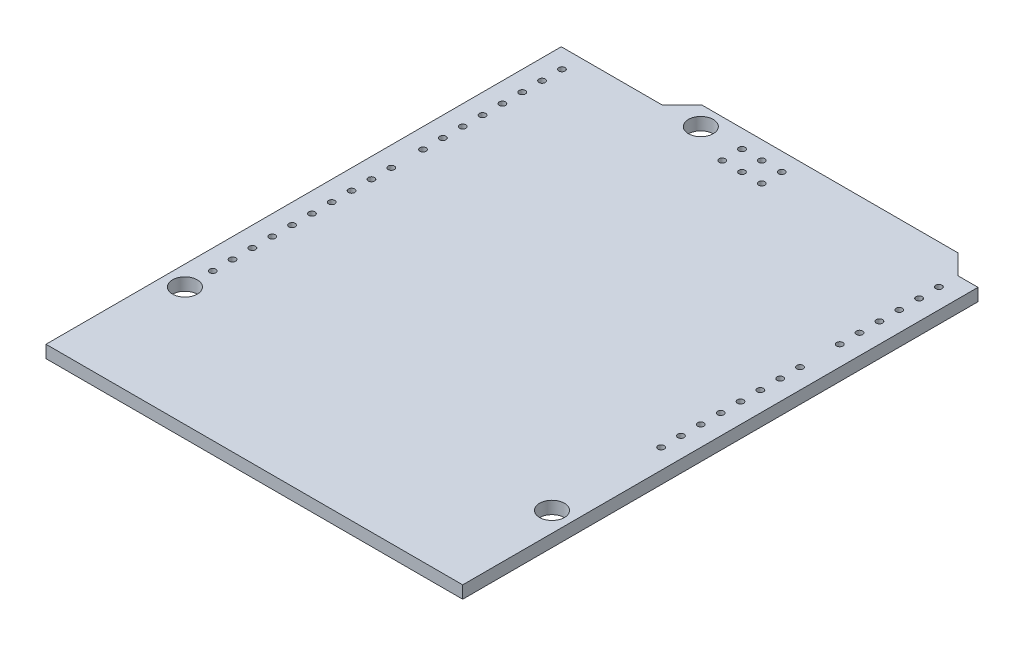
from build123d import *

# Parameters (mm, degrees)
SKETCH1_R           = 1.5875
BOSS_EXTRUDE1_DEPTH = 1.6
SKETCH2_R           = 0.4
CUT_EXTRUDE1_DEPTH  = 1.65
SKETCH3_R           = 0.4
CUT_EXTRUDE2_DEPTH  = 1.65
LPATTERN1_COUNT     = 15
LPATTERN1_PITCH     = 2.54
SKETCH4_R           = 0.4
CUT_EXTRUDE3_DEPTH  = 1.65
LPATTERN2_COUNT     = 10
LPATTERN2_PITCH     = 2.54
LPATTERN3_COUNT     = 17
LPATTERN3_PITCH     = 2.54
SKETCH5_R           = 0.4
CUT_EXTRUDE4_DEPTH  = 10


with BuildPart() as part:
    # Sketch1 → Boss-Extrude1 (new body)
    with BuildSketch(Plane(origin=(0, 0, 0), x_dir=(1, 0, 0), z_dir=(0, 1, 0))):
        Polygon((0, 0), (-53.34, 0), (-53.34, 65.96), (-40.386, 65.96), (-37.846, 68.5), (-5.08, 68.5), (-2.54, 65.96), (0, 65.96), align=None)
        with Locations(Location((-35.56, 66.04, 0), (0, 0, 270))):
            Circle(SKETCH1_R, mode=Mode.SUBTRACT)
        with Locations(Location((-2.54, 13.97, 0), (0, 0, 270))):
            Circle(SKETCH1_R, mode=Mode.SUBTRACT)
        with Locations(Location((-50.8, 15.24, 0), (0, 0, 270))):
            Circle(SKETCH1_R, mode=Mode.SUBTRACT)
    extrude(amount=-BOSS_EXTRUDE1_DEPTH)

    # Sketch2 → Cut-Extrude1 (cut)
    with BuildSketch(Plane(origin=(0, 0, 0), x_dir=(1, 0, 0), z_dir=(0, 1, 0))):
        with Locations(Location((-2.54, 27.94, 0), (0, 0, 270))):
            Circle(SKETCH2_R)
    cut_extrude1 = extrude(amount=-CUT_EXTRUDE1_DEPTH, mode=Mode.SUBTRACT)

    # Sketch3 → Cut-Extrude2 (cut)
    with BuildSketch(Plane(origin=(0, 0, 0), x_dir=(1, 0, 0), z_dir=(0, 1, 0))):
        with Locations(Location((-50.8, 18.796, 0), (0, 0, 270))):
            Circle(SKETCH3_R)
    cut_extrude2 = extrude(amount=-CUT_EXTRUDE2_DEPTH, mode=Mode.SUBTRACT)

    # LPattern1: Cut-Extrude1 ×15, 1 skipped
    with Locations(*[(0, 0, -i * LPATTERN1_PITCH) for i in range(1, LPATTERN1_COUNT) if i not in (8,)]):
        add(cut_extrude1, mode=Mode.SUBTRACT)

    # Sketch4 → Cut-Extrude3 (cut)
    with BuildSketch(Plane(origin=(0, 0, 0), x_dir=(1, 0, 0), z_dir=(0, 1, 0))):
        with Locations(Location((-50.8, 45.72, 0), (0, 0, 270))):
            Circle(SKETCH4_R)
    cut_extrude3 = extrude(amount=-CUT_EXTRUDE3_DEPTH, mode=Mode.SUBTRACT)

    # LPattern2: Cut-Extrude2 ×10
    with Locations(*[(0, 0, -i * LPATTERN2_PITCH) for i in range(1, LPATTERN2_COUNT)]):
        add(cut_extrude2, mode=Mode.SUBTRACT)

    # LPattern3: Cut-Extrude3 ×17, 1 skipped
    with Locations(*[(0, 0, -i * LPATTERN3_PITCH) for i in range(1, LPATTERN3_COUNT) if i not in (8,)]):
        add(cut_extrude3, mode=Mode.SUBTRACT)

    # Sketch5 → Cut-Extrude4 (cut)
    with BuildSketch(Plane(origin=(0, 0, 0), x_dir=(1, 0, 0), z_dir=(0, 1, 0))):
        with Locations(Location((-30.43, 66.18, 0), (0, 0, 270))):
            Circle(SKETCH5_R)
        with Locations(Location((-27.89, 66.18, 0), (0, 0, 270))):
            Circle(SKETCH5_R)
        with Locations(Location((-25.35, 66.18, 0), (0, 0, 270))):
            Circle(SKETCH5_R)
        with Locations(Location((-25.35, 63.64, 0), (0, 0, 270))):
            Circle(SKETCH5_R)
        with Locations(Location((-27.89, 63.64, 0), (0, 0, 270))):
            Circle(SKETCH5_R)
        with Locations(Location((-30.43, 63.64, 0), (0, 0, 270))):
            Circle(SKETCH5_R)
    extrude(amount=-CUT_EXTRUDE4_DEPTH, mode=Mode.SUBTRACT)


solid = part.part
